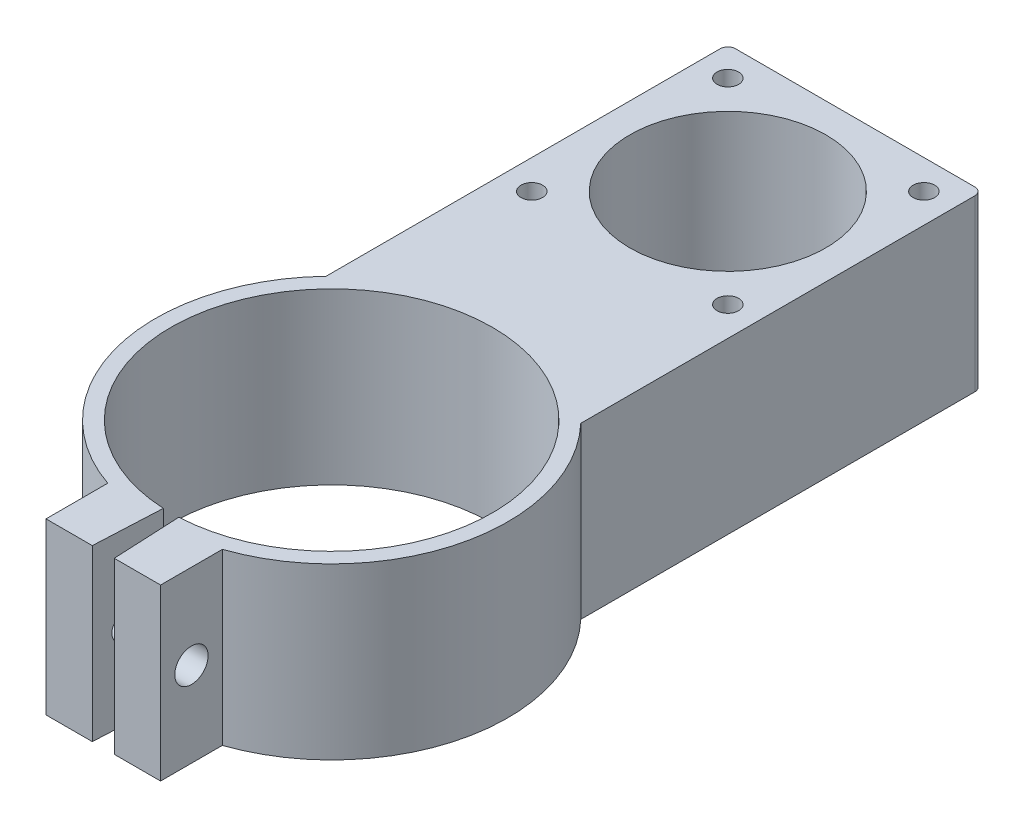
from build123d import *

# Parameters (mm, degrees)
BOSS_EXTRUDE1_DEPTH = 22
CUT_EXTRUDE1_REACH  = 79.458
SKETCH4_R           = 1.5875
CUT_EXTRUDE2_REACH  = 79.458
SKETCH5_R           = 2.159
SKETCH7_R           = 12.7
CUT_EXTRUDE3_DEPTH  = 75.871591195
SKETCH8_R           = 1.397
CUT_EXTRUDE4_DEPTH  = 75.871591195
CUT_EXTRUDE5_DEPTH  = 19
FILLET1_R           = 1


with BuildPart() as part:
    # Sketch1 → Boss-Extrude1 (new body)
    with BuildSketch(Plane(origin=(0, 0, 0), x_dir=(1, 0, 0), z_dir=(0, 1, 0))):
        with BuildLine():
            Line((1, -20.803980004), (1.422212938, -29.587689527))
            Line((1.422212938, -29.587689527), (7.422212938, -29.587689527))
            Line((7.422212938, -29.587689527), (7.422212938, -21.587689527))
            ThreePointArc((7.422212938, -21.587689527), (22.182667824, -5.389511316), (16.5, 15.775537519))
            Line((16.5, 15.775537519), (16.5, 67.828))
            Line((16.5, 67.828), (-16.5, 67.828))
            Line((-16.5, 67.828), (-16.5, 15.775537519))
            ThreePointArc((-16.5, 15.775537519), (-22.182667824, -5.389511316), (-7.422212938, -21.587689527))
            Line((-7.422212938, -21.587689527), (-7.422212938, -29.587689527))
            Line((-7.422212938, -29.587689527), (-1.422212938, -29.587689527))
            Line((-1.422212938, -29.587689527), (-1, -20.803980004))
            ThreePointArc((-1, -20.803980004), (0, 20.828), (1, -20.803980004))
        make_face()
    extrude(amount=BOSS_EXTRUDE1_DEPTH)

    # Cut-Extrude1: up to this plane
    cut_extrude1_end = Plane(origin=(-1, 22, 20.803980004), z_dir=(-0.9988467449508261, 0, -0.04801229114653368))
    # Sketch4 → Cut-Extrude1 (cut, up to the surface)
    with BuildSketch(Plane.ZY.offset(7.422212938), mode=Mode.PRIVATE) as cut_extrude1_sk1:
        with Locations((25.587689527, 11)):
            Circle(SKETCH4_R)
    cut_extrude1_tool1 = split(extrude(cut_extrude1_sk1.sketch, amount=-CUT_EXTRUDE1_REACH, mode=Mode.PRIVATE), bisect_by=cut_extrude1_end, keep=Keep.BOTH, mode=Mode.PRIVATE)
    add(cut_extrude1_tool1.solids().sort_by_distance((-7.422213, 11, 25.58769))[0], mode=Mode.SUBTRACT)

    # Cut-Extrude2: up to this plane
    cut_extrude2_end = Plane(origin=(1, 22, 20.803980004), z_dir=(0.9988467449508261, 0, -0.04801229114653392))
    # Sketch5 → Cut-Extrude2 (cut, up to the surface)
    with BuildSketch(Plane(origin=(7.422212938, 0, 0), x_dir=(0, 0, -1), z_dir=(1, 0, 0)), mode=Mode.PRIVATE) as cut_extrude2_sk1:
        with Locations((-25.587689527, 11)):
            Circle(SKETCH5_R)
    cut_extrude2_tool1 = split(extrude(cut_extrude2_sk1.sketch, amount=-CUT_EXTRUDE2_REACH, mode=Mode.PRIVATE), bisect_by=cut_extrude2_end, keep=Keep.BOTH, mode=Mode.PRIVATE)
    add(cut_extrude2_tool1.solids().sort_by_distance((7.422213, 11, 25.58769))[0], mode=Mode.SUBTRACT)

    # Sketch7 → Cut-Extrude3 (cut, through all)
    with BuildSketch(Plane.XZ):
        with Locations(Location((0, -51.328, 0), (0, 0, 270))):
            Circle(SKETCH7_R)
    extrude(amount=-CUT_EXTRUDE3_DEPTH, mode=Mode.SUBTRACT)

    # Sketch8 → Cut-Extrude4 (cut, through all)
    with BuildSketch(Plane(origin=(0, 22, 0), x_dir=(1, 0, 0), z_dir=(0, 1, 0))):
        with Locations(Location((12.7, 64.028, 0), (0, 0, 270))):
            Circle(SKETCH8_R)
        with Locations(Location((12.7, 38.628, 0), (0, 0, 270))):
            Circle(SKETCH8_R)
        with Locations(Location((-12.7, 38.628, 0), (0, 0, 270))):
            Circle(SKETCH8_R)
        with Locations(Location((-12.7, 64.028, 0), (0, 0, 270))):
            Circle(SKETCH8_R)
    extrude(amount=-CUT_EXTRUDE4_DEPTH, mode=Mode.SUBTRACT)

    # Sketch9 → Cut-Extrude5 (cut)
    with BuildSketch(Plane.XZ):
        with BuildLine():
            Line((-13.5, -34.628), (13.5, -34.628))
            Line((13.5, -34.628), (13.5, -19.634754493))
            ThreePointArc((13.5, -19.634754493), (0, -23.828), (-13.5, -19.634754493))
            Line((-13.5, -19.634754493), (-13.5, -34.628))
        make_face()
    extrude(amount=-CUT_EXTRUDE5_DEPTH, mode=Mode.SUBTRACT)

    # Fillet1
    fillet1_edges = [part.edges().sort_by_distance(p)[0] for p in [
        (-16.5, 11, -67.828),
        (16.5, 11, -67.828),
    ]]
    fillet(fillet1_edges, radius=FILLET1_R)


solid = part.part
